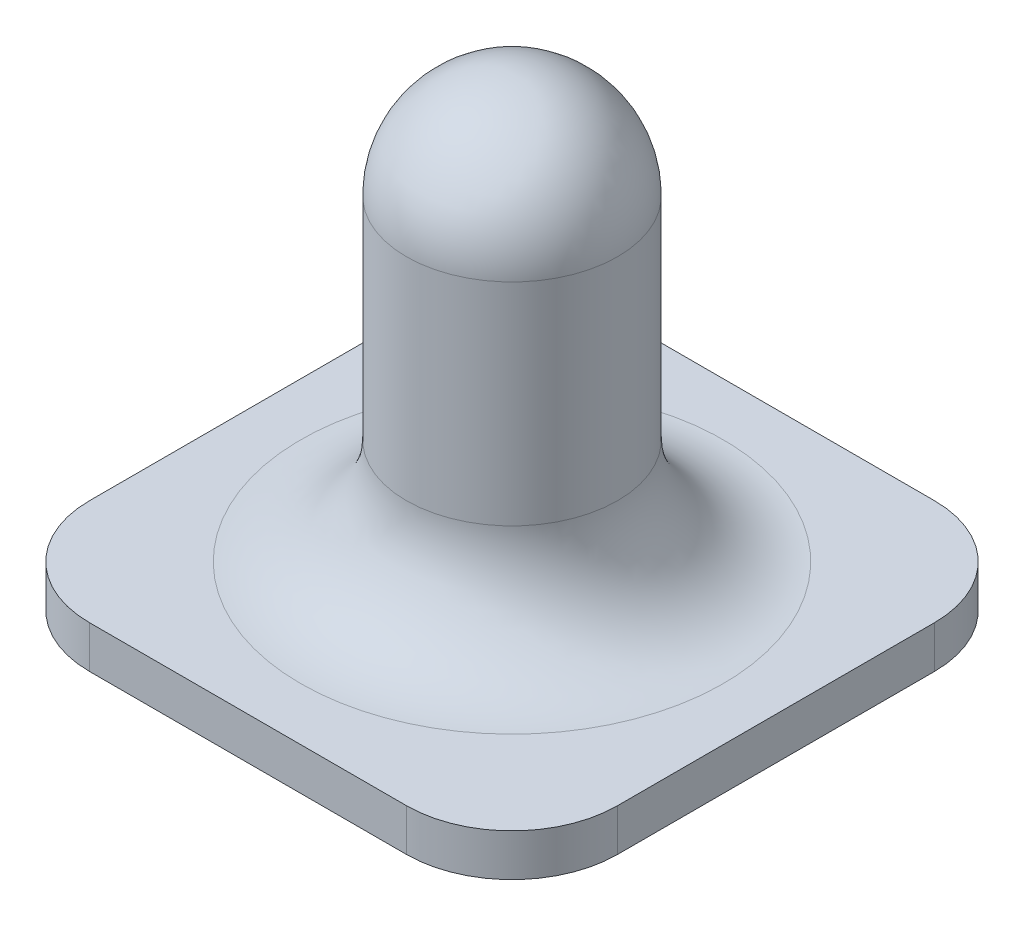
from build123d import *

# Parameters (mm, degrees)
SKETCH_1_W      = 50
SKETCH_1_H      = 50
EXTRUDE_1_DEPTH = 4
SKETCH_2_R      = 10
EXTRUDE_2_DEPTH = 40
FILLET_1_R      = 10
FILLET_2_R      = 10
FILLET_3_R      = 10


with BuildPart() as part:
    # 草图1 → 凸台-拉伸1 (new body)
    with BuildSketch(Plane(origin=(0, 0, 0), x_dir=(1, 0, 0), z_dir=(0, 1, 0))):
        with Locations((25, -25)):
            Rectangle(SKETCH_1_W, SKETCH_1_H)
    extrude(amount=EXTRUDE_1_DEPTH)

    # 草图2 → 凸台-拉伸2 (add)
    with BuildSketch(Plane(origin=(0, 4, 0), x_dir=(1, 0, 0), z_dir=(0, 1, 0))):
        with Locations(Location((25, -25, 0), (0, 0, 270))):
            Circle(SKETCH_2_R)
    extrude(amount=EXTRUDE_2_DEPTH)

    # 圆角1
    fillet_1_edges = [part.edges().sort_by_distance(p)[0] for p in [
        (25, 4, 15),
    ]]
    fillet(fillet_1_edges, radius=FILLET_1_R)

    # 圆角2
    fillet_2_edges = [part.edges().sort_by_distance(p)[0] for p in [
        (25, 44, 15),
    ]]
    fillet(fillet_2_edges, radius=FILLET_2_R)

    # 圆角3
    fillet_3_edges = [part.edges().sort_by_distance(p)[0] for p in [
        (0, 2, 0),
        (50, 2, 0),
        (50, 2, 50),
        (0, 2, 50),
    ]]
    fillet(fillet_3_edges, radius=FILLET_3_R)


solid = part.part
